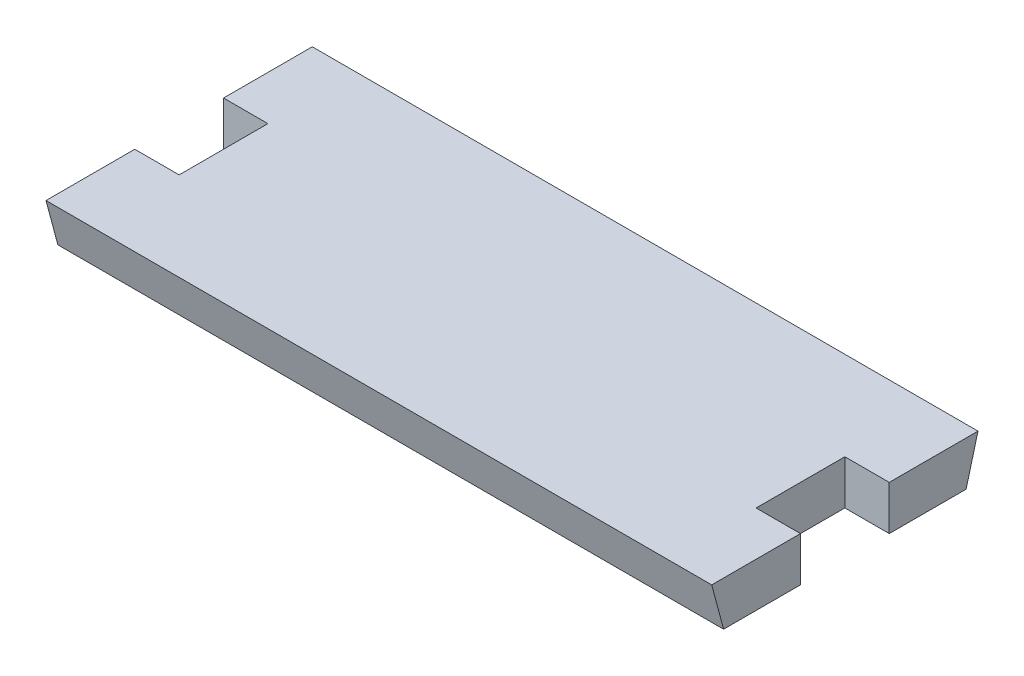
from build123d import *

# Parameters (mm, degrees)
SKETCH1_W           = 150
SKETCH1_H           = 60
BOSS_EXTRUDE1_DEPTH = 10
DRAFT1_ANGLE        = -15
SKETCH2_W           = 10
SKETCH2_H           = 20
CUT_EXTRUDE1_DEPTH  = 82.39410298


with BuildPart() as part:
    # Sketch1 → Boss-Extrude1 (new body)
    with BuildSketch(Plane(origin=(0, 0, 0), x_dir=(1, 0, 0), z_dir=(0, 1, 0))):
        Rectangle(SKETCH1_W, SKETCH1_H)
    extrude(amount=BOSS_EXTRUDE1_DEPTH)

    # Draft1
    draft1_faces = [part.faces().sort_by_distance(p)[0] for p in [
        (0, 5, -30),
        (0, 5, 30),
    ]]
    draft(draft1_faces, Plane.ZX.offset(10), DRAFT1_ANGLE)

    # Sketch2 → Cut-Extrude1 (cut, through all)
    with BuildSketch(Plane.XZ):
        with Locations((-70, 0)):
            Rectangle(SKETCH2_W, SKETCH2_H)
    cut_extrude1 = extrude(amount=-CUT_EXTRUDE1_DEPTH, mode=Mode.SUBTRACT)

    # Mirror1: Cut-Extrude1 across plane
    add(cut_extrude1.mirror(Plane(origin=(0, 0, 0), x_dir=(0, 0, 1), z_dir=(1, 0, 0))), mode=Mode.SUBTRACT)


solid = part.part
